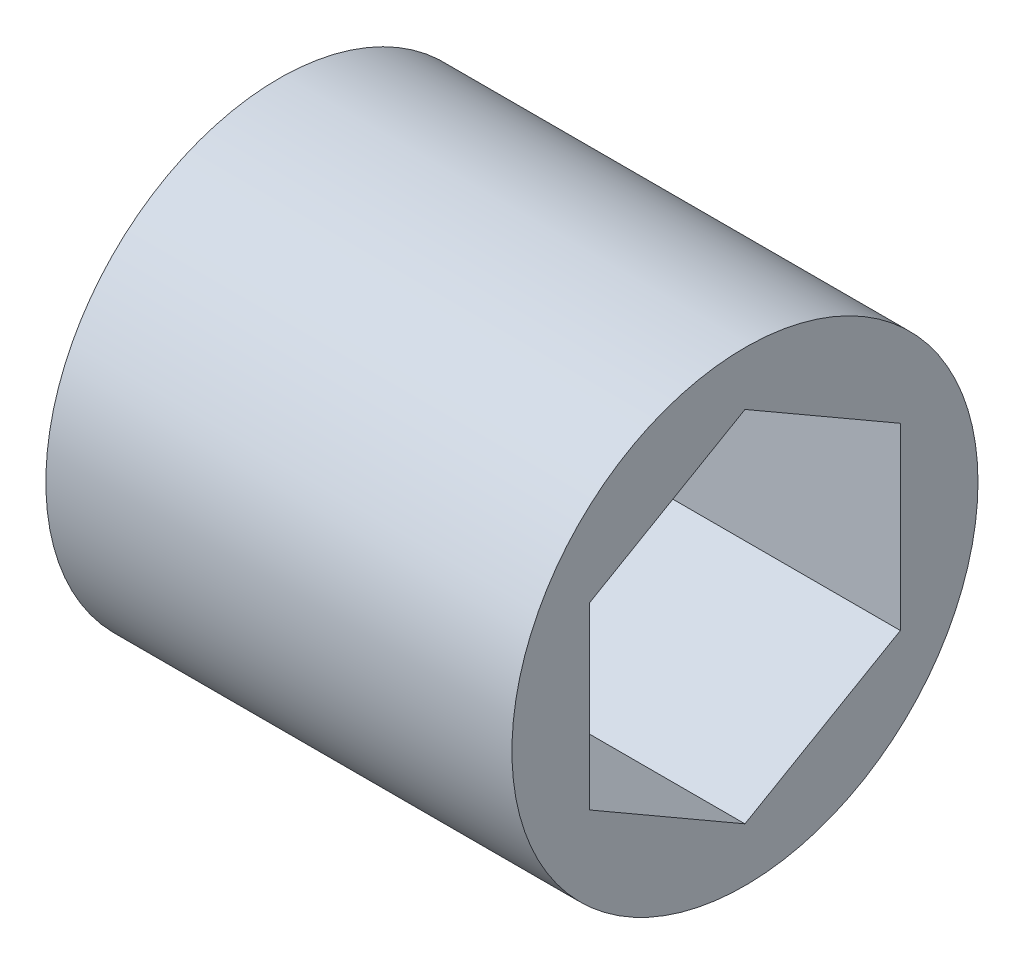
from build123d import *

# Parameters (mm, degrees)
BUSHING_PROFILE_R = 6.35
BUSHING_DEPTH     = 12.7


with BuildPart() as part:
    # Bushing Profile → Bushing (new body)
    with BuildSketch(Plane(origin=(0, 0, 0), x_dir=(0, 0, -1), z_dir=(1, 0, 0))):
        Circle(BUSHING_PROFILE_R)
        Polygon((0, -4.8895), (4.234431212, -2.44475), (4.234431212, 2.44475), (0, 4.8895), (-4.234431212, 2.44475), (-4.234431212, -2.44475), align=None, mode=Mode.SUBTRACT)
    extrude(amount=BUSHING_DEPTH)


solid = part.part
